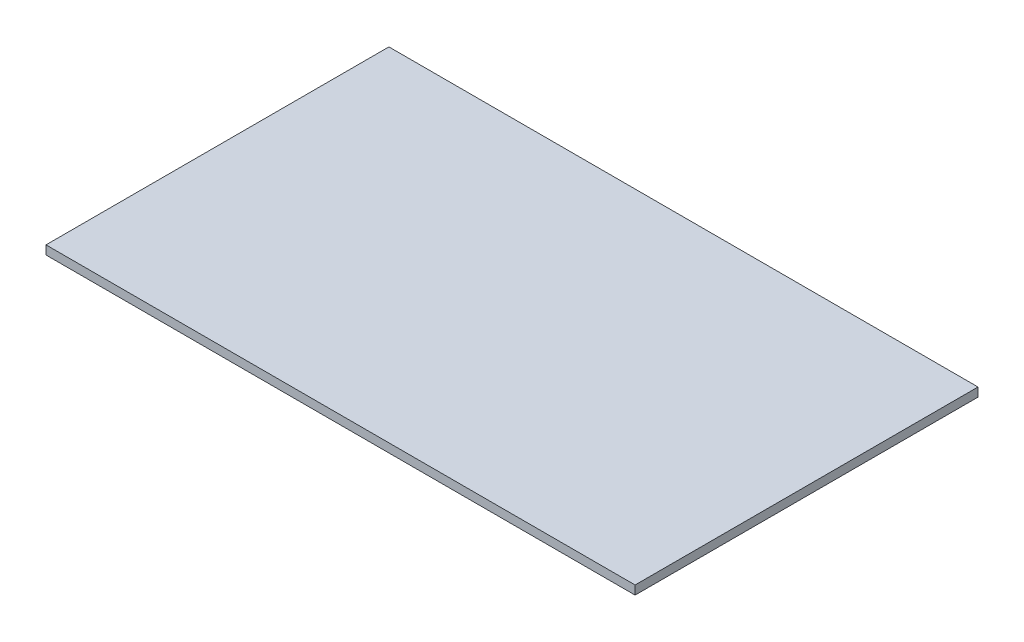
from build123d import *

# Parameters (mm, degrees)
SKETCH_1_W      = 67
SKETCH_1_H      = 39
EXTRUDE_1_DEPTH = 1


with BuildPart() as part:
    # 草图1 → 凸台-拉伸1 (new body)
    with BuildSketch(Plane(origin=(0, 0, 0), x_dir=(1, 0, 0), z_dir=(0, 1, 0))):
        Rectangle(SKETCH_1_W, SKETCH_1_H)
    extrude(amount=EXTRUDE_1_DEPTH)


solid = part.part
